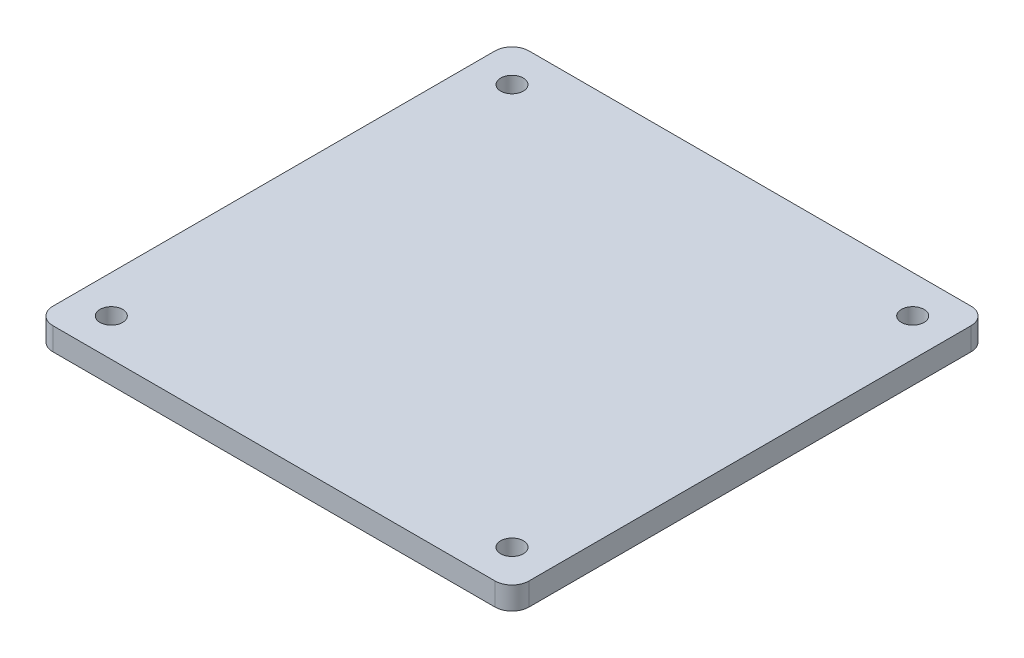
from build123d import *

# Parameters (mm, degrees)
SKETCH1_R           = 10
BOSS_EXTRUDE1_DEPTH = 20


with BuildPart() as part:
    # Sketch1 → Boss-Extrude1 (new body)
    with BuildSketch(Plane(origin=(0, 0, 0), x_dir=(1, 0, 0), z_dir=(0, 1, 0))):
        with BuildLine():
            Line((-195, -210), (195, -210))
            ThreePointArc((195, -210), (205.606601718, -205.606601718), (210, -195))
            Line((210, -195), (210, 195))
            ThreePointArc((210, 195), (205.606601718, 205.606601718), (195, 210))
            Line((195, 210), (-195, 210))
            ThreePointArc((-195, 210), (-205.606601718, 205.606601718), (-210, 195))
            Line((-210, 195), (-210, -195))
            ThreePointArc((-210, -195), (-205.606601718, -205.606601718), (-195, -210))
        make_face()
        with Locations(Location((176.776695297, 176.776695297, 0), (0, 0, 270))):
            Circle(SKETCH1_R, mode=Mode.SUBTRACT)
        with Locations(Location((176.776695297, -176.776695297, 0), (0, 0, 90))):
            Circle(SKETCH1_R, mode=Mode.SUBTRACT)
        with Locations(Location((-176.776695297, -176.776695297, 0), (0, 0, 270))):
            Circle(SKETCH1_R, mode=Mode.SUBTRACT)
        with Locations(Location((-176.776695297, 176.776695297, 0), (0, 0, 90))):
            Circle(SKETCH1_R, mode=Mode.SUBTRACT)
    extrude(amount=BOSS_EXTRUDE1_DEPTH)


solid = part.part
